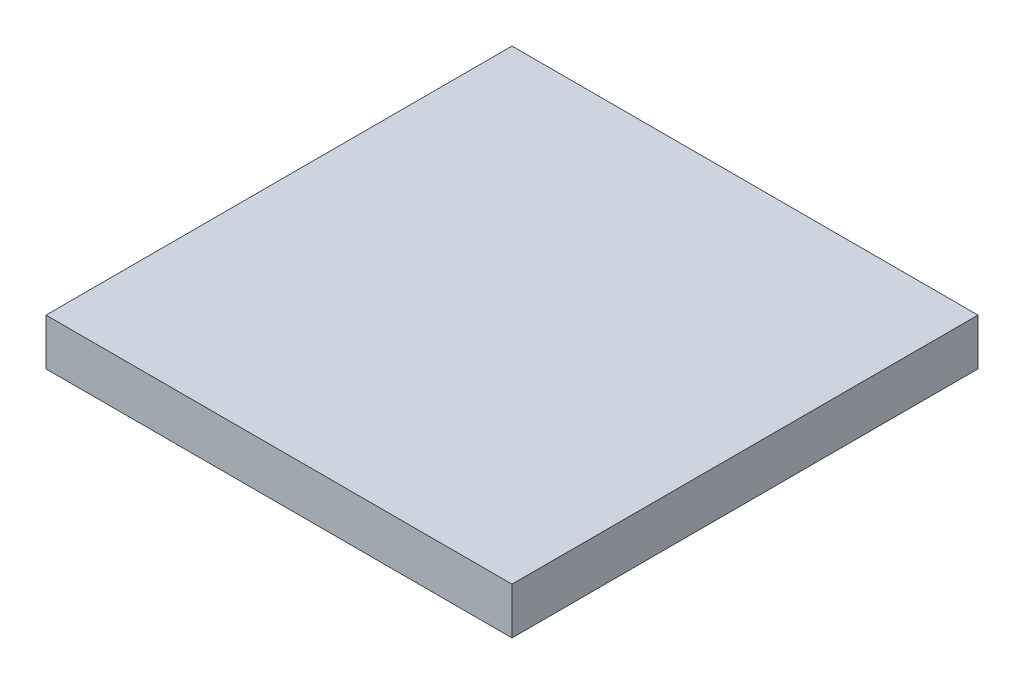
from build123d import *

# Parameters (mm, degrees)
SKETCH1_W           = 200
SKETCH1_H           = 200
BOSS_EXTRUDE1_DEPTH = 20


with BuildPart() as part:
    # Sketch1 → Boss-Extrude1 (new body)
    with BuildSketch(Plane(origin=(0, 0, 0), x_dir=(1, 0, 0), z_dir=(0, 1, 0))):
        with Locations((53.648899674, 118.347310546)):
            Rectangle(SKETCH1_W, SKETCH1_H)
    extrude(amount=BOSS_EXTRUDE1_DEPTH)


solid = part.part
